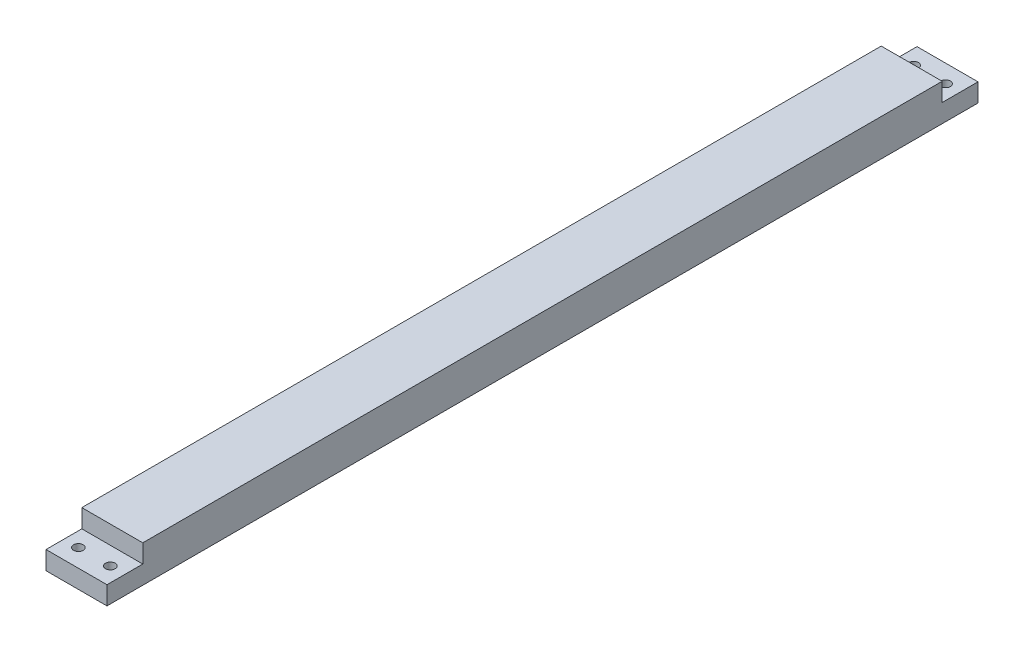
from build123d import *

# Parameters (mm, degrees)
ESQUISSE1_W             = 63
ESQUISSE1_H             = 38
BOSS_EXTRU_1_DEPTH      = 900
ESQUISSE2_W             = 37
ESQUISSE2_H             = 19
ENL_V_MAT_EXTRU_1_DEPTH = 904.002214837
ESQUISSE3_R             = 5
ENL_V_MAT_EXTRU_2_DEPTH = 903.402349288


with BuildPart() as part:
    # Esquisse1 → Boss.-Extru.1 (new body)
    with BuildSketch(Plane.XY):
        with Locations((31.5, 19)):
            Rectangle(ESQUISSE1_W, ESQUISSE1_H)
    extrude(amount=BOSS_EXTRU_1_DEPTH)

    # Esquisse2 → Enlèv. mat.-Extru.1 (cut, through all)
    with BuildSketch(Plane.ZY):
        with Locations((18.5, 28.5)):
            Rectangle(ESQUISSE2_W, ESQUISSE2_H)
        with Locations((881.5, 28.5)):
            Rectangle(ESQUISSE2_W, ESQUISSE2_H)
    extrude(amount=-ENL_V_MAT_EXTRU_1_DEPTH, mode=Mode.SUBTRACT)

    # Esquisse3 → Enlèv. mat.-Extru.2 (cut, through all)
    with BuildSketch(Plane(origin=(0, 19, 0), x_dir=(1, 0, 0), z_dir=(0, 1, 0))):
        with Locations(Location((15, -18.5, 0), (0, 0, 270))):
            Circle(ESQUISSE3_R)
        with Locations(Location((48, -18.5, 0), (0, 0, 90))):
            Circle(ESQUISSE3_R)
        with Locations(Location((48, -881.5, 0), (0, 0, 270))):
            Circle(ESQUISSE3_R)
        with Locations(Location((15, -881.5, 0), (0, 0, 90))):
            Circle(ESQUISSE3_R)
    extrude(amount=-ENL_V_MAT_EXTRU_2_DEPTH, mode=Mode.SUBTRACT)


solid = part.part
